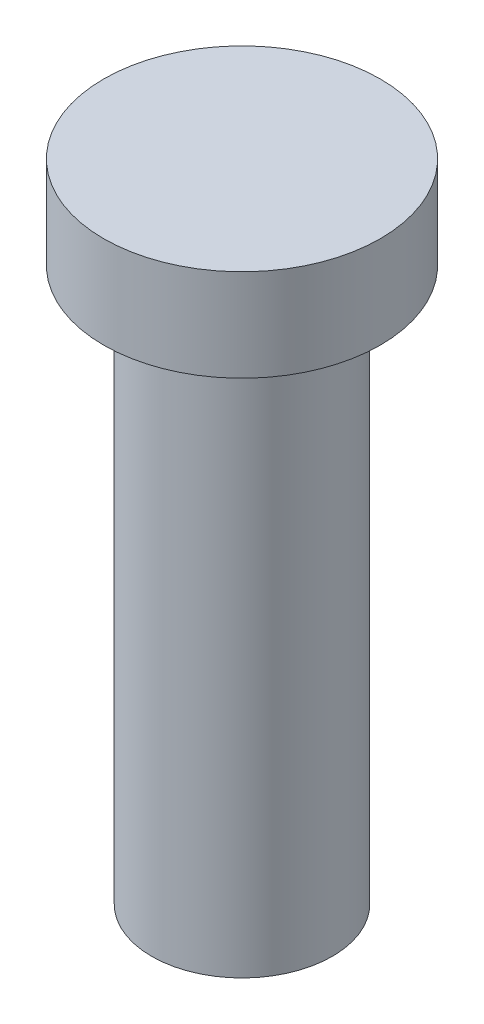
from build123d import *

# Parameters (mm, degrees)
SKETCH1_R           = 9.8
BOSS_EXTRUDE1_DEPTH = 60
SKETCH2_R           = 15
BOSS_EXTRUDE2_DEPTH = 10


with BuildPart() as part:
    # Sketch1 → Boss-Extrude1 (new body)
    with BuildSketch(Plane(origin=(0, 0, 0), x_dir=(1, 0, 0), z_dir=(0, 1, 0))):
        with Locations(Location((0, 0, 0), (0, 0, 270))):
            Circle(SKETCH1_R)
    extrude(amount=BOSS_EXTRUDE1_DEPTH)

    # Sketch2 → Boss-Extrude2 (add)
    with BuildSketch(Plane(origin=(0, 60, 0), x_dir=(1, 0, 0), z_dir=(0, 1, 0))):
        with Locations(Location((0, 0, 0), (0, 0, 270))):
            Circle(SKETCH2_R)
    extrude(amount=BOSS_EXTRUDE2_DEPTH)


solid = part.part
